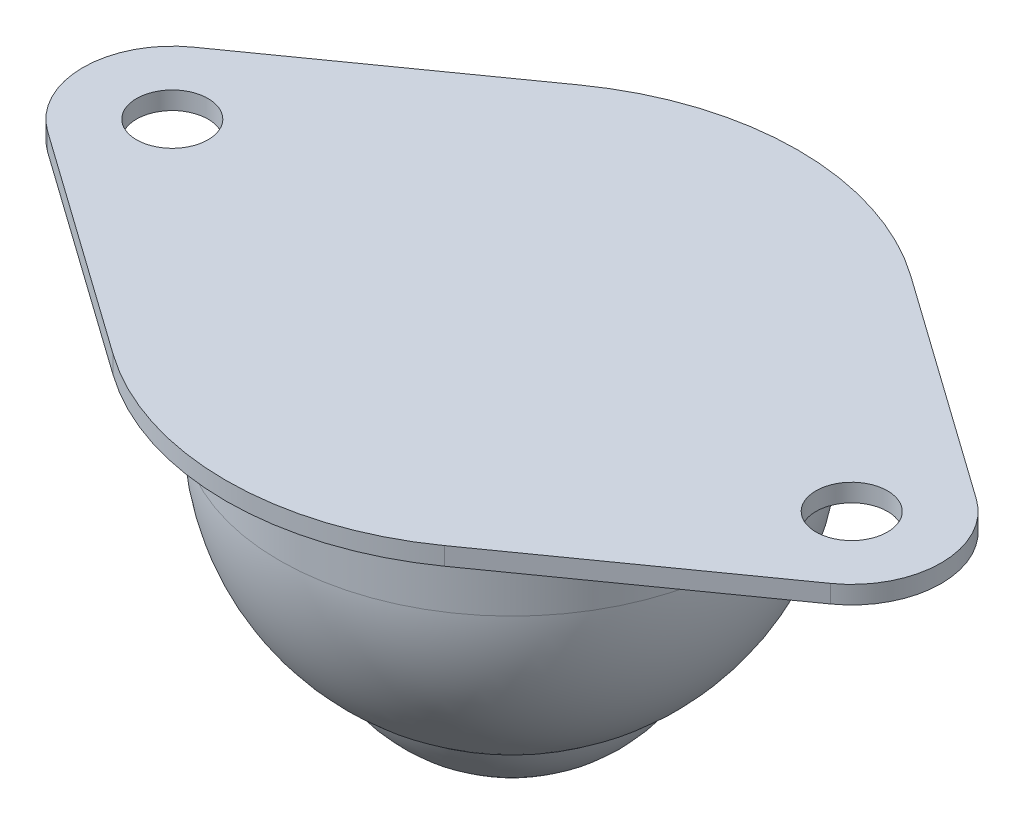
from build123d import *

# Parameters (mm, degrees)
SKETCH3_R           = 2
BOSS_EXTRUDE1_DEPTH = 1


with BuildPart() as part:
    # Sketch1 → Revolve1 (revolve)
    with BuildSketch(Plane(origin=(0, 0, 0), x_dir=(1, 0, 0), z_dir=(0, 1, 0))):
        with BuildLine():
            Line((0, 8.5), (0, -8.5))
            ThreePointArc((0, -8.5), (8.5, 0), (0, 8.5))
        make_face()
    revolve(axis=Axis((0, 0, -8.5), (0, 0, 1)))

    # Sketch2 → Revolve2 (revolve)
    with BuildSketch(Plane.XY, mode=Mode.PRIVATE) as revolve2_sk:
        with BuildLine():
            Line((13, 6.618380291), (13, 11))
            Line((13, 11), (0, 11))
            Line((0, 11), (0, 10))
            Line((0, 10), (12, 10))
            Line((12, 10), (12, 6.618380291))
            ThreePointArc((12, 6.618380291), (11.018242025, 1.864608874), (8.233609553, -2.111320376))
            ThreePointArc((8.233609553, -2.111320376), (7.923281837, -3.077597265), (7.5, -4))
            ThreePointArc((7.5, -4), (11.543396381, 0.639249919), (13, 6.618380291))
        make_face()
    revolve(revolve2_sk.sketch.rotate(Axis((0, 11, 0), (0, -1, 0)), 90), axis=Axis((0, 11, 0), (0, -1, 0)))

    # Sketch3 → Boss-Extrude1 (add)
    with BuildSketch(Plane(origin=(0, 11, 0), x_dir=(1, 0, 0), z_dir=(0, 1, 0))):
        with BuildLine():
            Line((-21.894736842, 4.076824575), (-9.263157895, 13.04583864))
            ThreePointArc((-9.263157895, 13.04583864), (0, 16), (9.263157895, 13.04583864))
            Line((9.263157895, 13.04583864), (21.894736842, 4.076824575))
            ThreePointArc((21.894736842, 4.076824575), (24, 0), (21.894736842, -4.076824575))
            Line((21.894736842, -4.076824575), (9.263157895, -13.04583864))
            ThreePointArc((9.263157895, -13.04583864), (0, -16), (-9.263157895, -13.04583864))
            Line((-9.263157895, -13.04583864), (-21.894736842, -4.076824575))
            ThreePointArc((-21.894736842, -4.076824575), (-24, 0), (-21.894736842, 4.076824575))
        make_face()
        with Locations(Location((-19, 0, 0), (0, 0, 270))):
            Circle(SKETCH3_R, mode=Mode.SUBTRACT)
        with Locations(Location((19, 0, 0), (0, 0, 90))):
            Circle(SKETCH3_R, mode=Mode.SUBTRACT)
    extrude(amount=BOSS_EXTRUDE1_DEPTH)


solid = part.part
